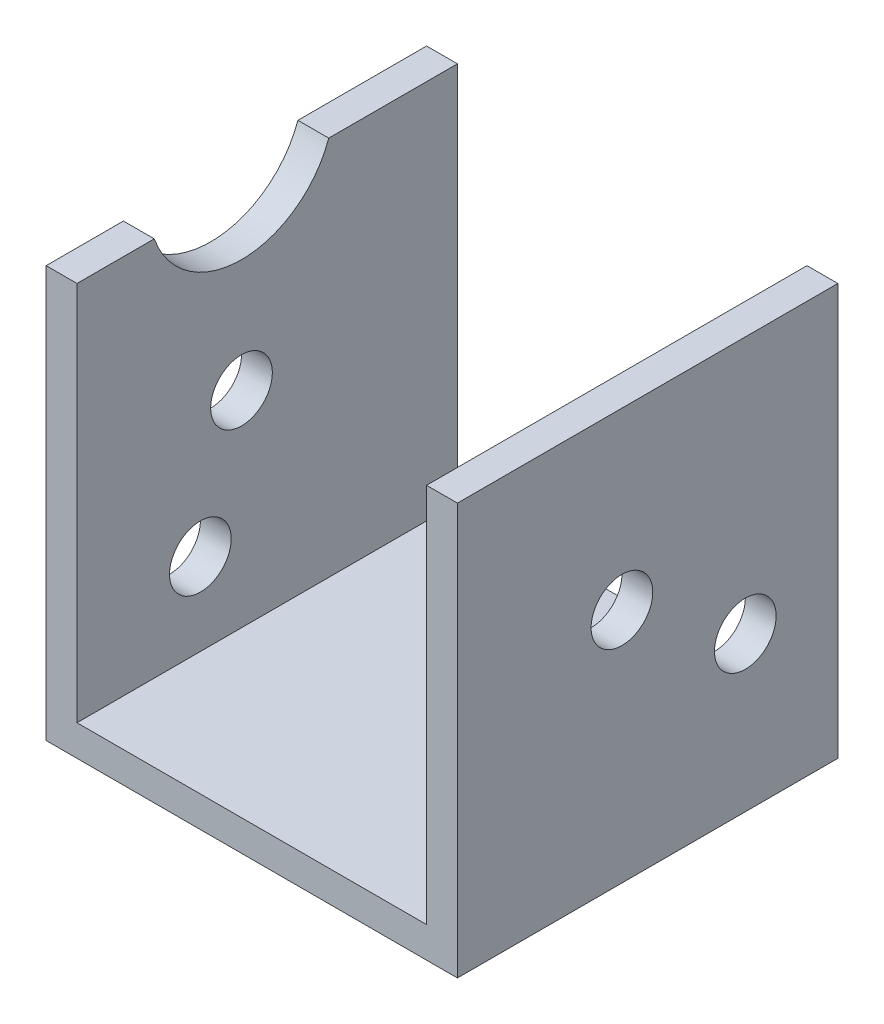
from build123d import *

# Parameters (mm, degrees)
EXTRUSION1_DEPTH = 18.5
ESQUISSE2_R      = 1.5
EXTRUSION2_DEPTH = 5
ESQUISSE3_R      = 4.5
ESQUISSE3_R_2    = 1.5
EXTRUSION3_DEPTH = 5
ESQUISSE5_R      = 1.5
EXTRUSION4_DEPTH = 34.008102077


with BuildPart() as part:
    # Esquisse1 → Extrusion1 (new body)
    with BuildSketch(Plane.XY):
        Polygon((-16.636265327, 18.635578947), (-16.636265327, -1.364421053), (3.363734673, -1.364421053), (3.363734673, 18.635578947), (1.863734673, 18.635578947), (1.863734673, 0.135578947), (-15.136265327, 0.135578947), (-15.136265327, 18.635578947), align=None)
    extrude(amount=EXTRUSION1_DEPTH)

    # Esquisse2 → Extrusion2 (cut)
    with BuildSketch(Plane(origin=(3.363734673, 0, 0), x_dir=(0, 0, -1), z_dir=(1, 0, 0))):
        with Locations((-4.5, 6.135578947)):
            Circle(ESQUISSE2_R)
    extrude(amount=-EXTRUSION2_DEPTH, mode=Mode.SUBTRACT)

    # Esquisse3 → Extrusion3 (cut)
    with BuildSketch(Plane.ZY.offset(16.636265327)):
        with Locations((10.5, 20.135578947)):
            Circle(ESQUISSE3_R)
        with Locations(Location((12.5, 4.135578947, 0), (0, 0, 270))):
            Circle(ESQUISSE3_R_2)
    extrude(amount=-EXTRUSION3_DEPTH, mode=Mode.SUBTRACT)

    # Esquisse5 → Extrusion4 (cut, through all)
    with BuildSketch(Plane.ZY.offset(16.636265327)):
        with Locations(Location((10.5, 10.135578947, 0), (0, 0, 270))):
            Circle(ESQUISSE5_R)
    extrude(amount=-EXTRUSION4_DEPTH, mode=Mode.SUBTRACT)


solid = part.part
